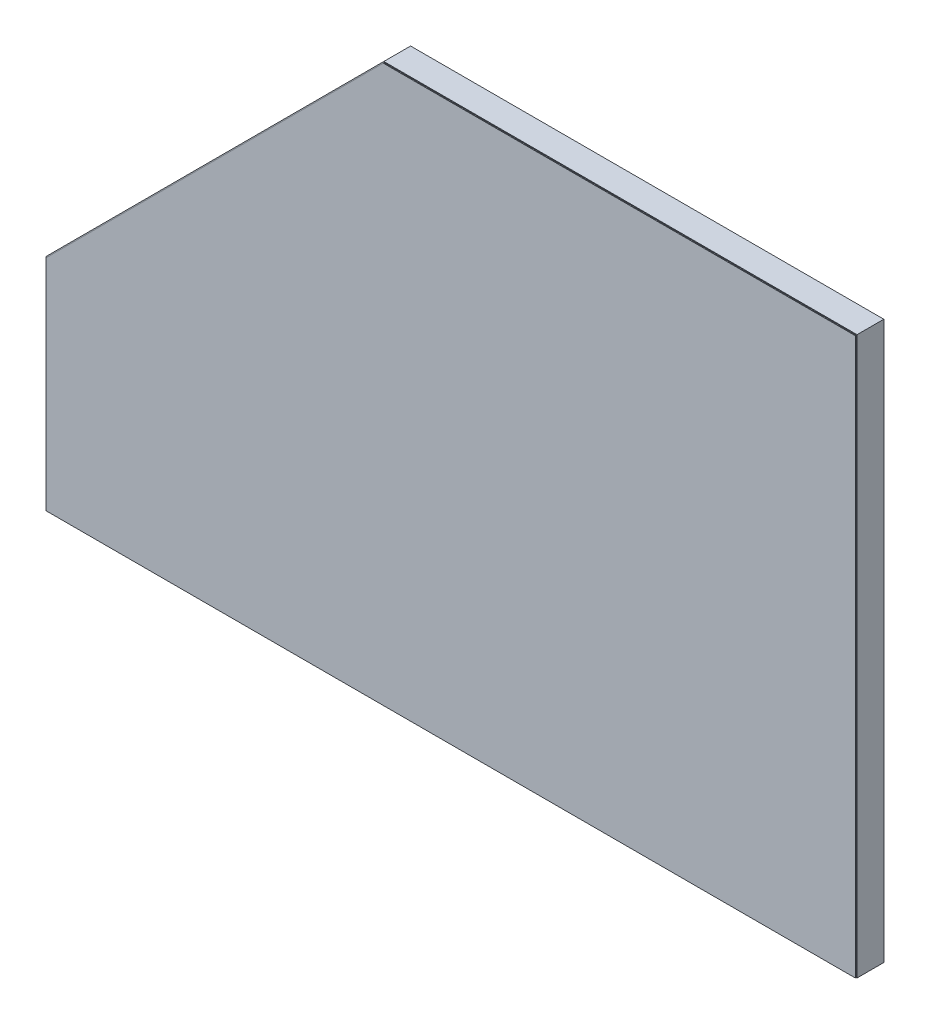
from build123d import *

# Parameters (mm, degrees)
SALIENTE_EXTRUIR1_DEPTH = 0.83566
SALIENTE_EXTRUIR2_DEPTH = 25.4


with BuildPart() as part:
    # Croquis1 → Saliente-Extruir1 (new body)
    with BuildSketch(Plane.XY):
        Polygon((0, 0), (768, 0), (768, 528), (320, 528), (0, 208), align=None)
    extrude(amount=SALIENTE_EXTRUIR1_DEPTH)


with BuildPart() as body_2:
    # Croquis3 → Saliente-Extruir2 (new body)
    with BuildSketch(Plane(origin=(0, 0, 0), x_dir=(-1, 0, 0), z_dir=(0, 0, -1))):
        Polygon((0.83566, 0), (0.83566, 208.346141706), (-319.653858294, 528.83566), (-768.83566, 528.83566), (-768.83566, 0), (-768, 0), (-768, 528), (-320, 528), (0, 208), (0, 0), align=None)
    extrude(amount=SALIENTE_EXTRUIR2_DEPTH)


solid = Compound([part.part, body_2.part])
